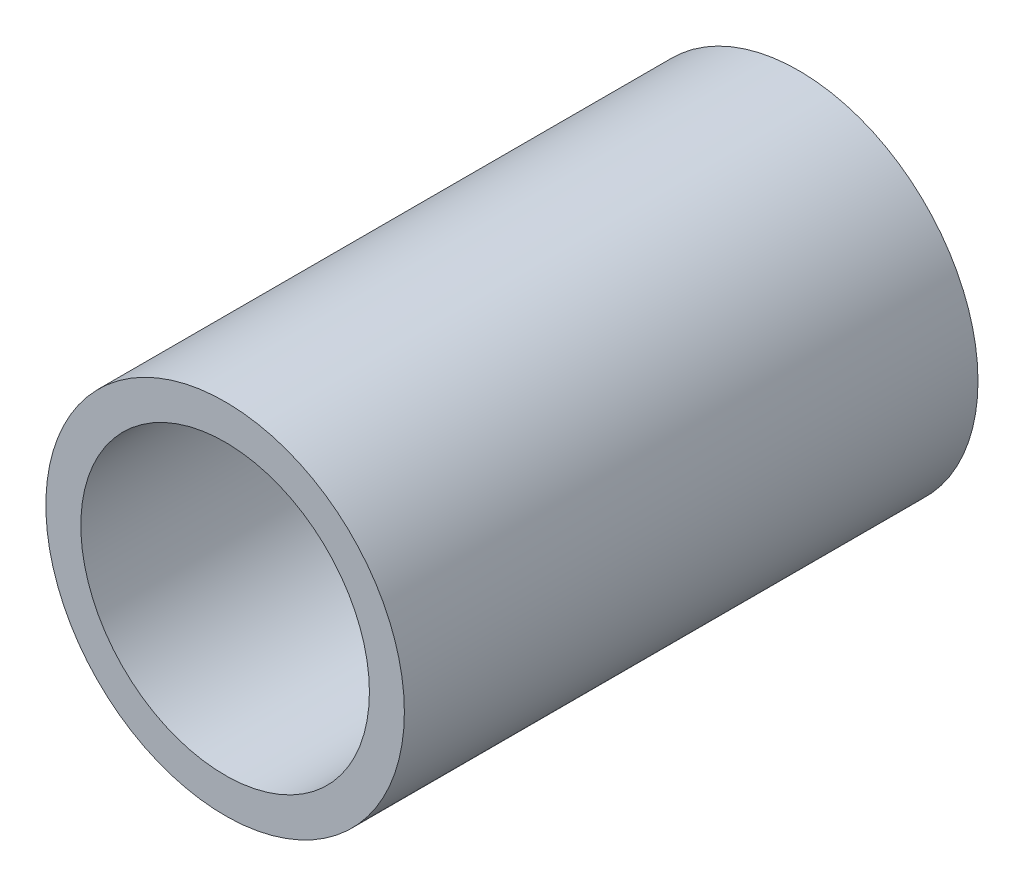
from build123d import *

# Parameters (mm, degrees)
SKETCH1_R           = 5
SKETCH1_R_2         = 4.025
BOSS_EXTRUDE1_DEPTH = 16


with BuildPart() as part:
    # Sketch1 → Boss-Extrude1 (new body)
    with BuildSketch(Plane.XY):
        Circle(SKETCH1_R)
        Circle(SKETCH1_R_2, mode=Mode.SUBTRACT)
    extrude(amount=BOSS_EXTRUDE1_DEPTH)


solid = part.part
